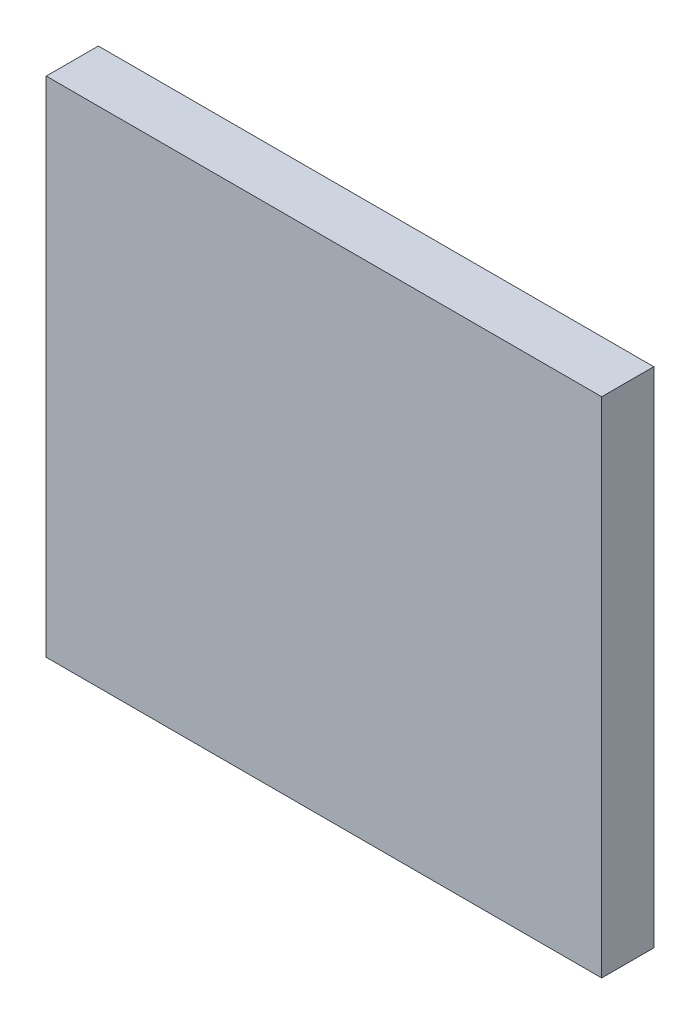
from build123d import *

# Parameters (mm, degrees)
SKETCH1_W           = 50.8
SKETCH1_H           = 46.0375
BOSS_EXTRUDE1_DEPTH = 4.7625


with BuildPart() as part:
    # Sketch1 → Boss-Extrude1 (new body)
    with BuildSketch(Plane.XY):
        with Locations((25.4, 23.01875)):
            Rectangle(SKETCH1_W, SKETCH1_H)
    extrude(amount=BOSS_EXTRUDE1_DEPTH)


solid = part.part
